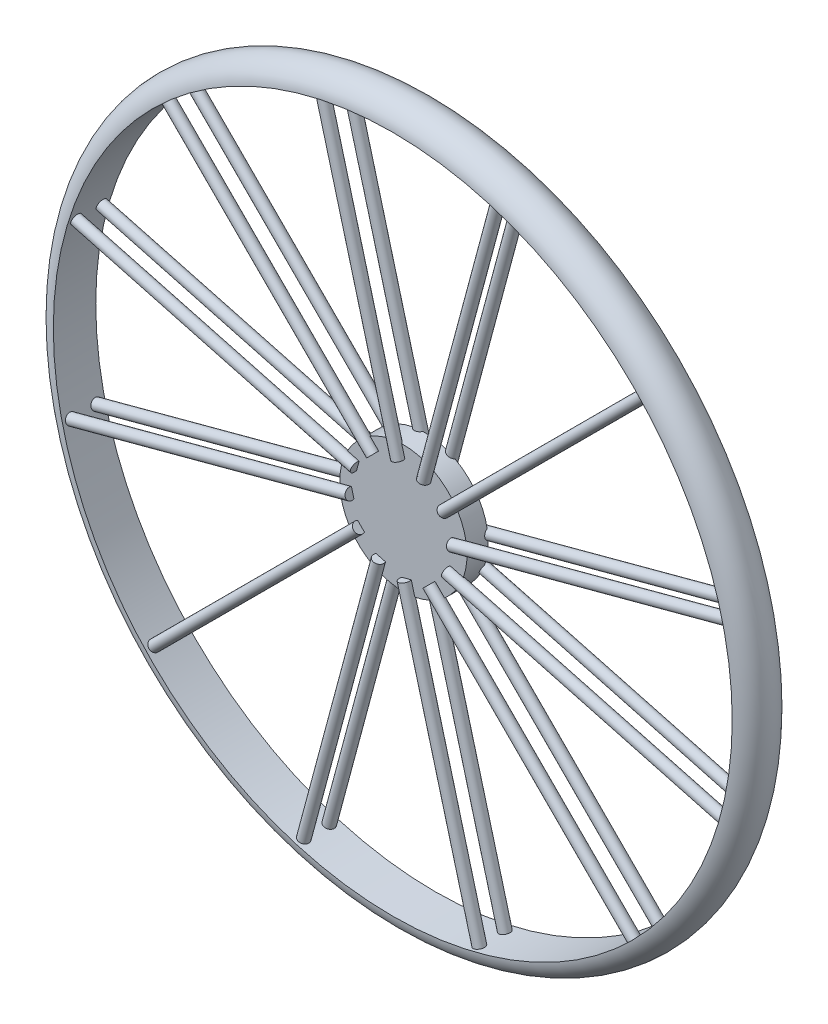
from build123d import *

# Parameters (mm, degrees)
SKETCH4_R           = 76.2
BOSS_EXTRUDE2_DEPTH = 12.7
SKETCH6_R           = 76.2
BOSS_EXTRUDE3_DEPTH = 12.7
CIRPATTERN2_COUNT   = 12


with BuildPart() as part:
    # Sketch1 → Revolve1 (revolve)
    with BuildSketch(Plane(origin=(0, 0, 0), x_dir=(1, 0, 0), z_dir=(0, 1, 0))):
        with BuildLine():
            Line((0, 0), (0, -25.4))
            ThreePointArc((0, -25.4), (-23.608299444, 0), (0, 25.4))
            Line((0, 25.4), (0, 0))
        make_face()
    revolve(axis=Axis((406.4, 0, 0), (0, 0, -1)))



with BuildPart() as body_2:
    # Sketch4 → Boss-Extrude2 (new body)
    with BuildSketch(Plane.XY):
        with Locations((406.4, 0)):
            Circle(SKETCH4_R)
    extrude(amount=BOSS_EXTRUDE2_DEPTH)

    # Sketch6 → Boss-Extrude3 (add)
    with BuildSketch(Plane(origin=(0, 0, 0), x_dir=(-1, 0, 0), z_dir=(0, 0, -1))):
        with Locations((-406.4, 0)):
            Circle(SKETCH6_R)
    extrude(amount=BOSS_EXTRUDE3_DEPTH)


with BuildPart() as part_1:
    add(part.part)

    add(body_2.part)  # Revolve-Thin3 merges body 2
    # Sketch7 → Revolve-Thin3 (revolve)
    with BuildSketch(Plane.XY.offset(15.24)):
        Polygon((457.055449439, 33.698048577), (702.891014756, 279.533613893), (698.400886696, 284.023741954), (452.565321379, 38.188176637), align=None)
    revolve_thin3 = revolve(axis=Axis((457.055449439, 33.698048577, 15.24), (0.7071067811865462, 0.7071067811865488, 0)))

    # CirPattern2: Revolve-Thin3 ×12 about axis
    cirpattern2_axis = Axis((406.4, 0, 0), (0, 0, -1))
    for i in range(1, CIRPATTERN2_COUNT):
        add(revolve_thin3.rotate(cirpattern2_axis, i * 360 / CIRPATTERN2_COUNT))

    # Mirror1 copy 1 sketch → Mirror1 copy 1 (revolve)
    with BuildSketch(Plane(origin=(54.447275902, 203.2, -15.24), x_dir=(0.8660254037844387, -0.49999999999999994, 0), z_dir=(0, 0, -1))):
        Polygon((457.055449439, -33.698048577), (702.891014756, -279.533613893), (698.400886696, -284.023741954), (452.565321379, -38.188176637), align=None)
    revolve(axis=Axis((467.117930343, 3.855641406, -15.24), (-0.9659258262890678, -0.2588190451025226, 0)))

    # Mirror1 copy 2 sketch → Mirror1 copy 2 (revolve)
    with BuildSketch(Plane(origin=(203.2, 351.952724098, -15.24), x_dir=(0.5000000000000001, -0.8660254037844386, 0), z_dir=(0, 0, -1))):
        Polygon((457.055449439, -33.698048577), (702.891014756, -279.533613893), (698.400886696, -284.023741954), (452.565321379, -38.188176637), align=None)
    revolve(axis=Axis((460.911090845, -27.019881766, -15.24), (-0.9659258262890688, 0.2588190451025189, 0)))

    # Mirror1 copy 3 sketch → Mirror1 copy 3 (revolve)
    with BuildSketch(Plane(origin=(406.4, 406.4, -15.24), x_dir=(0, -1, 0), z_dir=(0, 0, -1))):
        Polygon((457.055449439, -33.698048577), (702.891014756, -279.533613893), (698.400886696, -284.023741954), (452.565321379, -38.188176637), align=None)
    revolve(axis=Axis((440.098048577, -50.655449439, -15.24), (-0.7071067811865488, 0.7071067811865462, 0)))

    # Mirror1 copy 4 sketch → Mirror1 copy 4 (revolve)
    with BuildSketch(Plane(origin=(609.6, 351.952724098, -15.24), x_dir=(-0.4999999999999998, -0.8660254037844387, 0), z_dir=(0, 0, -1))):
        Polygon((457.055449439, -33.698048577), (702.891014756, -279.533613893), (698.400886696, -284.023741954), (452.565321379, -38.188176637), align=None)
    revolve(axis=Axis((410.255641406, -60.717930343, -15.24), (-0.25881904510252274, 0.9659258262890678, 0)))

    # Mirror1 copy 5 sketch → Mirror1 copy 5 (revolve)
    with BuildSketch(Plane(origin=(758.352724098, 203.2, -15.24), x_dir=(-0.8660254037844387, -0.49999999999999994, 0), z_dir=(0, 0, -1))):
        Polygon((457.055449439, -33.698048577), (702.891014756, -279.533613893), (698.400886696, -284.023741954), (452.565321379, -38.188176637), align=None)
    revolve(axis=Axis((379.380118234, -54.511090845, -15.24), (0.25881904510251913, 0.9659258262890688, 0)))

    # Mirror1 copy 6 sketch → Mirror1 copy 6 (revolve)
    with BuildSketch(Plane(origin=(812.8, 0, -15.24), x_dir=(-1, 0, 0), z_dir=(0, 0, -1))):
        Polygon((457.055449439, -33.698048577), (702.891014756, -279.533613893), (698.400886696, -284.023741954), (452.565321379, -38.188176637), align=None)
    revolve(axis=Axis((355.744550561, -33.698048577, -15.24), (0.7071067811865461, 0.7071067811865489, 0)))

    # Mirror1 copy 7 sketch → Mirror1 copy 7 (revolve)
    with BuildSketch(Plane(origin=(758.352724098, -203.2, -15.24), x_dir=(-0.8660254037844386, 0.5000000000000001, 0), z_dir=(0, 0, -1))):
        Polygon((457.055449439, -33.698048577), (702.891014756, -279.533613893), (698.400886696, -284.023741954), (452.565321379, -38.188176637), align=None)
    revolve(axis=Axis((345.682069657, -3.855641406, -15.24), (0.9659258262890678, 0.2588190451025224, 0)))

    # Mirror1 copy 8 sketch → Mirror1 copy 8 (revolve)
    with BuildSketch(Plane(origin=(609.6, -351.952724098, -15.24), x_dir=(-0.5000000000000004, 0.8660254037844384, 0), z_dir=(0, 0, -1))):
        Polygon((457.055449439, -33.698048577), (702.891014756, -279.533613893), (698.400886696, -284.023741954), (452.565321379, -38.188176637), align=None)
    revolve(axis=Axis((351.888909155, 27.019881766, -15.24), (0.9659258262890689, -0.2588190451025185, 0)))

    # Mirror1 copy 9 sketch → Mirror1 copy 9 (revolve)
    with BuildSketch(Plane(origin=(406.4, -406.4, -15.24), x_dir=(0, 1, 0), z_dir=(0, 0, -1))):
        Polygon((457.055449439, -33.698048577), (702.891014756, -279.533613893), (698.400886696, -284.023741954), (452.565321379, -38.188176637), align=None)
    revolve(axis=Axis((372.701951423, 50.655449439, -15.24), (0.7071067811865489, -0.7071067811865461, 0)))

    # Mirror1 copy 10 sketch → Mirror1 copy 10 (revolve)
    with BuildSketch(Plane(origin=(203.2, -351.952724098, -15.24), x_dir=(0.5000000000000001, 0.8660254037844386, 0), z_dir=(0, 0, -1))):
        Polygon((457.055449439, -33.698048577), (702.891014756, -279.533613893), (698.400886696, -284.023741954), (452.565321379, -38.188176637), align=None)
    revolve(axis=Axis((402.544358594, 60.717930343, -15.24), (0.2588190451025224, -0.9659258262890678, 0)))

    # Mirror1 copy 11 sketch → Mirror1 copy 11 (revolve)
    with BuildSketch(Plane(origin=(54.447275902, -203.2, -15.24), x_dir=(0.8660254037844384, 0.5000000000000004, 0), z_dir=(0, 0, -1))):
        Polygon((457.055449439, -33.698048577), (702.891014756, -279.533613893), (698.400886696, -284.023741954), (452.565321379, -38.188176637), align=None)
    revolve(axis=Axis((433.419881766, 54.511090845, -15.24), (-0.2588190451025185, -0.9659258262890689, 0)))

    # Mirror1 copy 12 sketch → Mirror1 copy 12 (revolve)
    with BuildSketch(Plane(origin=(0, 0, -15.24), x_dir=(1, 0, 0), z_dir=(0, 0, -1))):
        Polygon((457.055449439, -33.698048577), (702.891014756, -279.533613893), (698.400886696, -284.023741954), (452.565321379, -38.188176637), align=None)
    revolve(axis=Axis((457.055449439, 33.698048577, -15.24), (-0.7071067811865462, -0.7071067811865488, 0)))


solid = part_1.part
